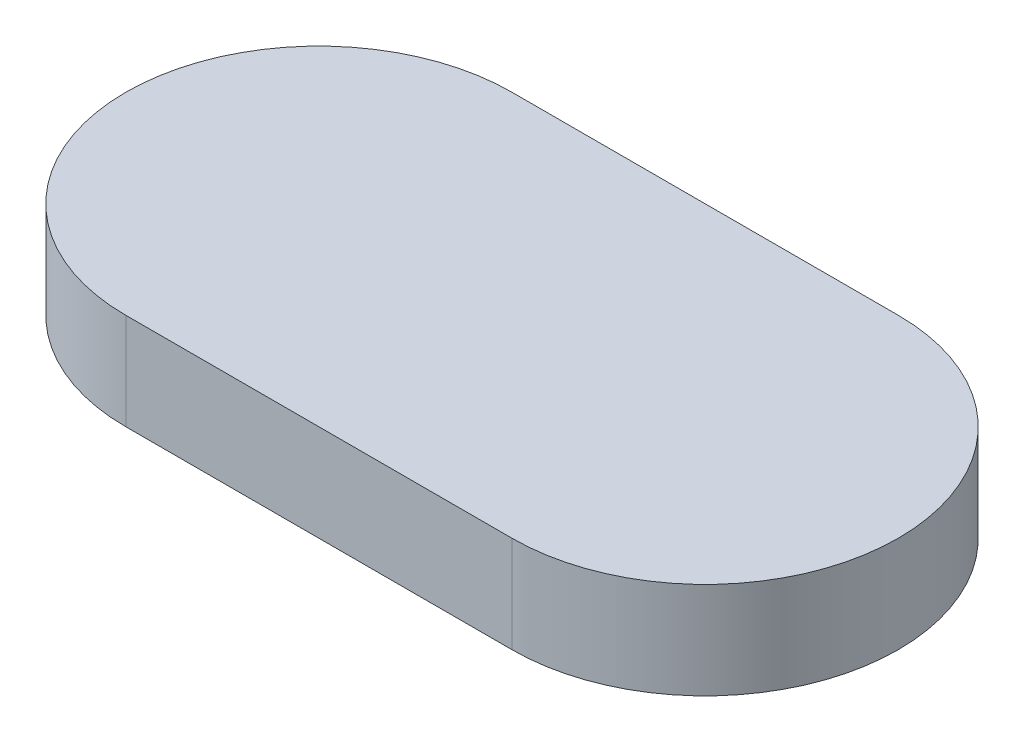
from build123d import *

# Parameters (mm, degrees)
EXTRUDE_1_DEPTH = 10


with BuildPart() as part:
    # 草图1 → 凸台-拉伸1 (new body)
    with BuildSketch(Plane(origin=(0, 0, 0), x_dir=(1, 0, 0), z_dir=(0, 1, 0))):
        with BuildLine():
            Line((0, -20), (-40, -20))
            ThreePointArc((-40, -20), (-60, 0), (-40, 20))
            Line((-40, 20), (0, 20))
            ThreePointArc((0, 20), (20, 0), (0, -20))
        make_face()
    extrude(amount=EXTRUDE_1_DEPTH)


solid = part.part
